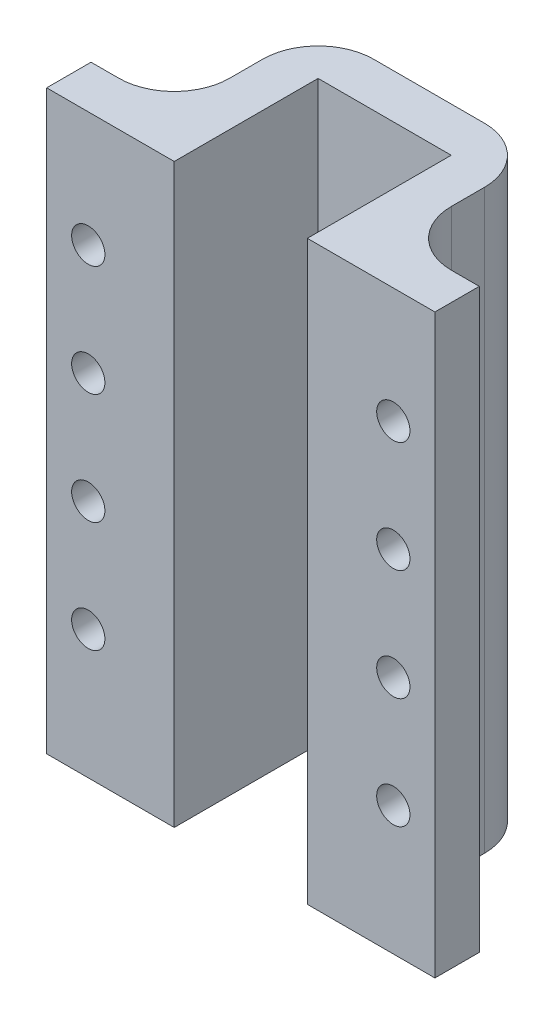
from build123d import *

# Parameters (mm, degrees)
EXTRUDE_1_DEPTH          = 52
FILLET_1_R               = 5
CUT_EXTRUDE_1_DEPTH      = 10
CUT_EXTRUDE_1_DEPTH_BACK = 10
SKETCH_2_R               = 1.5
CUT_EXTRUDE_2_DEPTH      = 10
CUT_EXTRUDE_2_DEPTH_BACK = 1.5


with BuildPart() as part:
    # Эскиз1 → Бобышка-Вытянуть1 (new body)
    with BuildSketch(Plane(origin=(0, 0, 0), x_dir=(1, 0, 0), z_dir=(0, 1, 0))):
        Polygon((-17.5, -4.485282754), (-17.5, -8.485282754), (-6, -8.485282754), (-6, 4.485282754), (6, 4.485282754), (6, -8.485282754), (17.5, -8.485282754), (17.5, -4.485282754), (10, -4.485282754), (10, 8.485282754), (-10, 8.485282754), (-10, -4.485282754), align=None)
    extrude(amount=EXTRUDE_1_DEPTH)

    # Скругление1
    fillet_1_edges = [part.edges().sort_by_distance(p)[0] for p in [
        (-10, 26, 4.485282754),
        (-10, 26, -8.485282754),
        (10, 26, -8.485282754),
        (10, 26, 4.485282754),
    ]]
    fillet(fillet_1_edges, radius=FILLET_1_R)

    # Эскиз2 → Вырез-Вытянуть1 (cut, two sides: drawn at the far end of the back side and taken through both)
    with BuildSketch(Plane(origin=(0, 0, 4.485282754), x_dir=(-1, 0, 0), z_dir=(0, 0, -1)).offset(-CUT_EXTRUDE_1_DEPTH_BACK)):
        with Locations(Location((13.75, 41.6, 0), (0, 0, 33.557309762))):
            Circle(SKETCH_2_R)
        with Locations(Location((13.75, 31.6, 0), (0, 0, 33.557309762))):
            Circle(SKETCH_2_R)
        with Locations(Location((13.75, 21.6, 0), (0, 0, 33.557309762))):
            Circle(SKETCH_2_R)
        with Locations(Location((13.75, 11.6, 0), (0, 0, 33.557309762))):
            Circle(SKETCH_2_R)
        with Locations(Location((-13.75, 41.6, 0), (0, 0, 213.557309762))):
            Circle(SKETCH_2_R)
        with Locations(Location((-13.75, 31.6, 0), (0, 0, 146.442690238))):
            Circle(SKETCH_2_R)
        with Locations(Location((-13.75, 21.6, 0), (0, 0, 146.442690238))):
            Circle(SKETCH_2_R)
        with Locations(Location((-13.75, 11.6, 0), (0, 0, 146.442690238))):
            Circle(SKETCH_2_R)
    extrude(amount=CUT_EXTRUDE_1_DEPTH + CUT_EXTRUDE_1_DEPTH_BACK, mode=Mode.SUBTRACT)

    # Эскиз3 → Вырез-Вытянуть2 (cut, two sides: drawn at the far end of the back side and taken through both)
    with BuildSketch(Plane(origin=(0, 0, 4.485282754), x_dir=(-1, 0, 0), z_dir=(0, 0, -1)).offset(-CUT_EXTRUDE_2_DEPTH_BACK)):
        Polygon((13.75, 38.424573519), (16.5, 40.01228676), (16.5, 43.18771324), (13.75, 44.775426481), (11, 43.18771324), (11, 40.01228676), align=None)
        Polygon((-11, 40.01228676), (-13.75, 38.424573519), (-16.5, 40.01228676), (-16.5, 43.18771324), (-13.75, 44.775426481), (-11, 43.18771324), align=None)
        Polygon((13.75, 28.424573519), (16.5, 30.01228676), (16.5, 33.18771324), (13.75, 34.775426481), (11, 33.18771324), (11, 30.01228676), align=None)
        Polygon((-11, 30.01228676), (-13.75, 28.424573519), (-16.5, 30.01228676), (-16.5, 33.18771324), (-13.75, 34.775426481), (-11, 33.18771324), align=None)
        Polygon((13.75, 18.424573519), (16.5, 20.01228676), (16.5, 23.18771324), (13.75, 24.775426481), (11, 23.18771324), (11, 20.01228676), align=None)
        Polygon((-11, 20.01228676), (-13.75, 18.424573519), (-16.5, 20.01228676), (-16.5, 23.18771324), (-13.75, 24.775426481), (-11, 23.18771324), align=None)
        Polygon((13.75, 8.424573519), (16.5, 10.01228676), (16.5, 13.18771324), (13.75, 14.775426481), (11, 13.18771324), (11, 10.01228676), align=None)
        Polygon((-11, 10.01228676), (-13.75, 8.424573519), (-16.5, 10.01228676), (-16.5, 13.18771324), (-13.75, 14.775426481), (-11, 13.18771324), align=None)
    extrude(amount=CUT_EXTRUDE_2_DEPTH + CUT_EXTRUDE_2_DEPTH_BACK, mode=Mode.SUBTRACT)


solid = part.part
